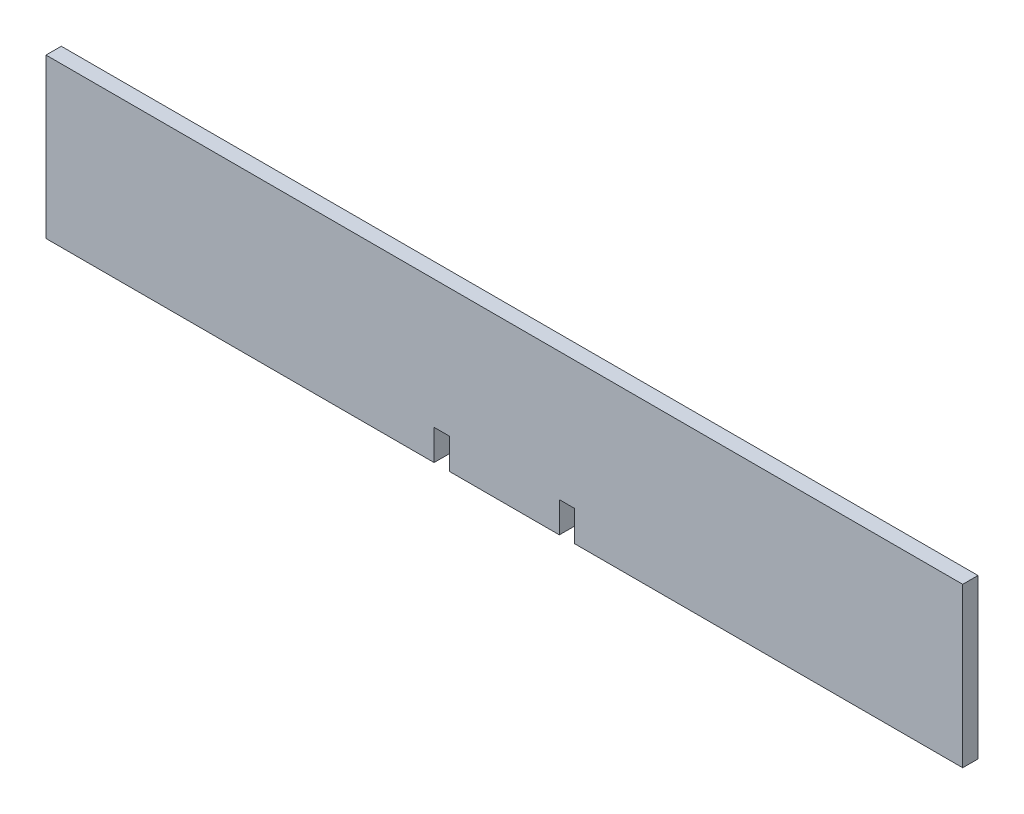
from build123d import *

# Parameters (mm, degrees)
BOSS_EXTRUDE1_DEPTH = 2.5


with BuildPart() as part:
    # Sketch1 → Boss-Extrude1 (new, symmetric)
    with BuildSketch(Plane.XY):
        Polygon((150, 26), (-150, 26), (-150, -26), (-23, -26), (-23, -16), (-18, -16), (-18, -26), (18, -26), (18, -16), (23, -16), (23, -26), (150, -26), align=None)
    extrude(amount=BOSS_EXTRUDE1_DEPTH, both=True)


solid = part.part
